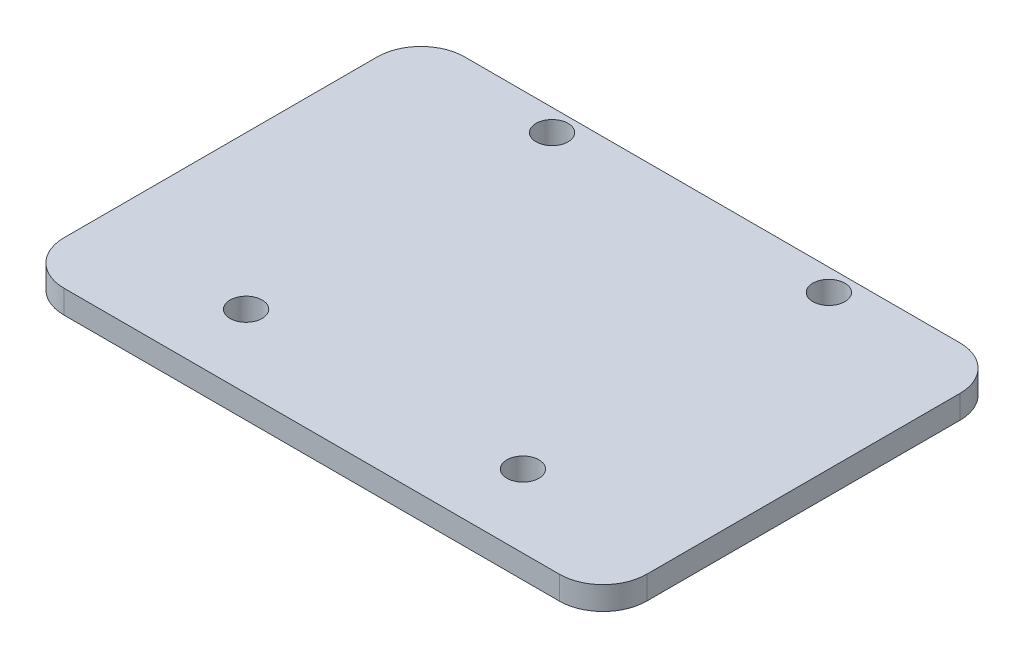
from build123d import *

# Parameters (mm, degrees)
SKETCH1_W                = 40
SKETCH1_H                = 27.5
BOSS_EXTRUDE1_DEPTH      = 1.6
M2_CLEARANCE_HOLE1_D     = 2.2
M2_CLEARANCE_HOLE1_DEPTH = 5.2
M2_CLEARANCE_HOLE1_TIP   = 0.660946681
FILLET1_R                = 3


with BuildPart() as part:
    # Sketch1 → Boss-Extrude1 (new body)
    with BuildSketch(Plane(origin=(0, 0, 0), x_dir=(1, 0, 0), z_dir=(0, 1, 0))):
        Rectangle(SKETCH1_W, SKETCH1_H)
    extrude(amount=BOSS_EXTRUDE1_DEPTH)

    # M2 Clearance Hole1
    with Locations(Plane(origin=(0, 1.6, 0), x_dir=(1, 0, 0), z_dir=(0, 1, 0))):
        with Locations((-9.5, 12.25), (9.5, 12.25), (9.5, -8.75), (-9.5, -8.75)):
            Hole(M2_CLEARANCE_HOLE1_D / 2, depth=M2_CLEARANCE_HOLE1_DEPTH)
            with Locations((0, 0, -(M2_CLEARANCE_HOLE1_DEPTH + M2_CLEARANCE_HOLE1_TIP / 2))):  # 118° drill point
                Cone(0, M2_CLEARANCE_HOLE1_D / 2, M2_CLEARANCE_HOLE1_TIP, mode=Mode.SUBTRACT)

    # Fillet1
    fillet1_edges = [part.edges().sort_by_distance(p)[0] for p in [
        (-20, 0.8, -13.75),
        (20, 0.8, -13.75),
        (20, 0.8, 13.75),
        (-20, 0.8, 13.75),
    ]]
    fillet(fillet1_edges, radius=FILLET1_R)


solid = part.part
